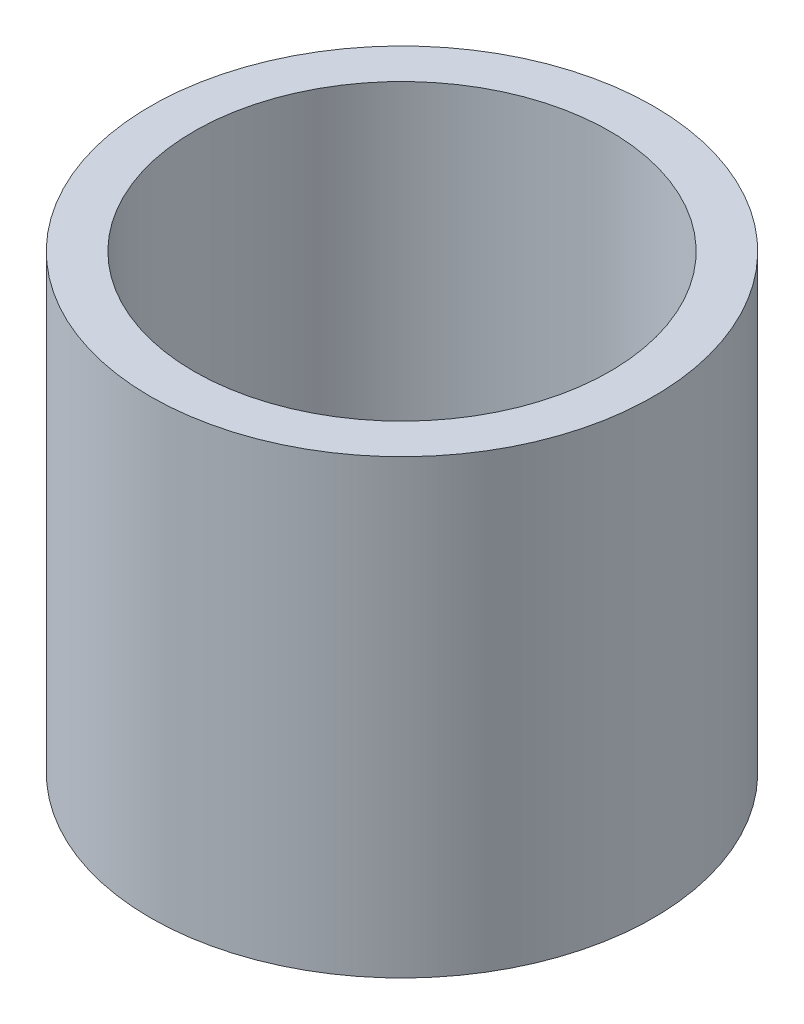
from build123d import *

# Parameters (mm, degrees)
SKETCH1_R           = 3.9
SKETCH1_R_2         = 3.225
BOSS_EXTRUDE1_DEPTH = 7


with BuildPart() as part:
    # Sketch1 → Boss-Extrude1 (new body)
    with BuildSketch(Plane(origin=(0, 0, 0), x_dir=(1, 0, 0), z_dir=(0, 1, 0))):
        with Locations(Location((0, 0, 0), (0, 0, 270))):
            Circle(SKETCH1_R)
        with Locations(Location((0, 0, 0), (0, 0, 270))):
            Circle(SKETCH1_R_2, mode=Mode.SUBTRACT)
    extrude(amount=BOSS_EXTRUDE1_DEPTH)


solid = part.part
